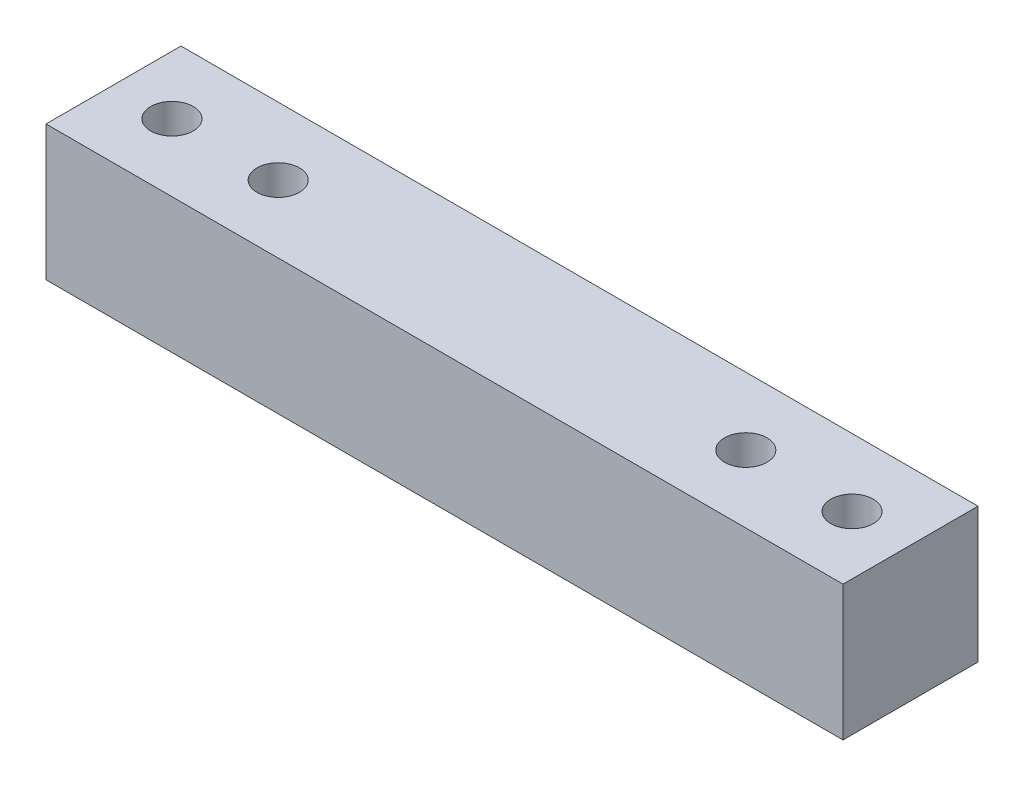
from build123d import *

# Parameters (mm, degrees)
SKETCH1_W           = 75
SKETCH1_H           = 12.7
BOSS_EXTRUDE1_DEPTH = 12.7
SKETCH2_R           = 2
CUT_EXTRUDE1_DEPTH  = 78.120554977
BOSS_EXTRUDE2_DEPTH = 1


with BuildPart() as part:
    # Sketch1 → Boss-Extrude1 (new body)
    with BuildSketch(Plane(origin=(0, 0, 0), x_dir=(1, 0, 0), z_dir=(0, 1, 0))):
        with Locations((37.5, 6.35)):
            Rectangle(SKETCH1_W, SKETCH1_H)
    extrude(amount=BOSS_EXTRUDE1_DEPTH)

    # Sketch2 → Cut-Extrude1 (cut, through all)
    with BuildSketch(Plane(origin=(0, 12.7, 0), x_dir=(1, 0, 0), z_dir=(0, 1, 0))):
        with Locations(Location((5.5, 6.35, 0), (0, 0, 270))):
            Circle(SKETCH2_R)
        with Locations(Location((15.5, 6.35, 0), (0, 0, 270))):
            Circle(SKETCH2_R)
        with Locations(Location((59.5, 6.35, 0), (0, 0, 270))):
            Circle(SKETCH2_R)
        with Locations(Location((69.5, 6.35, 0), (0, 0, 270))):
            Circle(SKETCH2_R)
    extrude(amount=-CUT_EXTRUDE1_DEPTH, mode=Mode.SUBTRACT)

    # Sketch3 → Boss-Extrude2 (add)
    # profile 1 of 3: a face of its own
    with BuildSketch(Plane.ZY):
        with BuildLine():
            Line((-8.766666667, 8), (-8.766666667, 7.641025641))
            Line((-8.766666667, 7.641025641), (-9.956470353, 7.641025641))
            Line((-9.956470353, 7.641025641), (-10.145773237, 6.720452724))
            add(Edge.make_bspline(
                [(-10.145773237, 6.720452724), (-10.108717363, 6.730682996), (-10.036927467, 6.75050253), (-9.930967606, 6.7725083), (-9.830375403, 6.785773744), (-9.765100032, 6.787585055), (-9.733513622, 6.788461538)],
                knots=[0, 0, 0, 0, 1.100273476, 2.13160584, 3.095893838, 4, 4, 4, 4], degree=3))
            add(Edge.make_bspline(
                [(-9.733513622, 6.788461538), (-9.694429882, 6.787615603), (-9.617581485, 6.785952282), (-9.505142538, 6.769980432), (-9.397809645, 6.744840518), (-9.295807274, 6.709719996), (-9.198946724, 6.664810263), (-9.108119162, 6.608710322), (-9.021961249, 6.543176991), (-8.942018655, 6.467831979), (-8.869494347, 6.384910363), (-8.805728357, 6.295752492), (-8.751565767, 6.201224829), (-8.708005012, 6.100424221), (-8.673220678, 5.994465067), (-8.650068683, 5.882232485), (-8.634651974, 5.764784365), (-8.632929588, 5.684479795), (-8.632051282, 5.643529647)],
                knots=[0, 0, 0, 0, 1.052922333, 2.070308379, 3.05430497, 4.020497103, 4.973039431, 5.925935799, 6.892292201, 7.88610001, 8.88166317, 9.857072816, 10.836096531, 11.812156883, 12.81219415, 13.836441305, 14.89672472, 16, 16, 16, 16], degree=3))
            add(Edge.make_bspline(
                [(-8.632051282, 5.643529647), (-8.632716357, 5.615007427), (-8.63403752, 5.55834844), (-8.640756108, 5.474204239), (-8.653691824, 5.391841406), (-8.671059548, 5.311249014), (-8.693601966, 5.232579642), (-8.72089102, 5.155608114), (-8.754287047, 5.080813507), (-8.790918422, 5.007488112), (-8.8321649, 4.937289605), (-8.877943408, 4.871640618), (-8.926308899, 4.809556337), (-8.978350284, 4.751702604), (-9.03455128, 4.698459586), (-9.094231246, 4.649511304), (-9.156913965, 4.604029974), (-9.223569208, 4.563861779), (-9.292711691, 4.526898823), (-9.365339908, 4.496575285), (-9.439800608, 4.469464757), (-9.517165484, 4.44785523), (-9.597259297, 4.430922675), (-9.680214072, 4.419422075), (-9.765594742, 4.411045637), (-9.823469755, 4.41052128), (-9.852704327, 4.41025641)],
                knots=[0, 0, 0, 0, 1.056347294, 2.098418968, 3.122841568, 4.141288669, 5.149314143, 6.15115421, 7.162517403, 8.180376062, 9.185164535, 10.17417709, 11.141909838, 12.097768115, 13.052685741, 14.0056014, 14.954263652, 15.917497458, 16.885230207, 17.854509472, 18.828990115, 19.81800267, 20.826176721, 21.857883937, 22.917946725, 24, 24, 24, 24], degree=3))
            add(Edge.make_bspline(
                [(-9.852704327, 4.41025641), (-9.887578508, 4.410947248), (-9.956189338, 4.41230639), (-10.056709905, 4.426524876), (-10.153424511, 4.446888792), (-10.245554612, 4.477525062), (-10.333925876, 4.515912357), (-10.417348594, 4.564428528), (-10.49795437, 4.619407632), (-10.572466407, 4.684287985), (-10.64162252, 4.755203667), (-10.703529029, 4.832161308), (-10.758662606, 4.91389075), (-10.806140353, 5.000788904), (-10.846638374, 5.092627435), (-10.878453362, 5.189750436), (-10.904131717, 5.29165044), (-10.914995138, 5.36180395), (-10.920512821, 5.397435897)],
                knots=[0, 0, 0, 0, 1.0467383, 2.05933395, 3.04377827, 4.011590433, 4.970194871, 5.932262533, 6.905835911, 7.896367577, 8.894135286, 9.877477877, 10.858688626, 11.851381753, 12.8477658, 13.868841284, 14.917554742, 16, 16, 16, 16], degree=3))
            Line((-10.920512821, 5.397435897), (-10.606410256, 5.397435897))
            add(Edge.make_bspline(
                [(-10.606410256, 5.397435897), (-10.598681699, 5.364059445), (-10.583826983, 5.29990805), (-10.551221234, 5.209776709), (-10.511355358, 5.129457485), (-10.46395101, 5.057887902), (-10.407400979, 4.995478905), (-10.342871551, 4.939861843), (-10.270523827, 4.889686713), (-10.190130598, 4.847863946), (-10.105317518, 4.812195193), (-10.016550308, 4.788443498), (-9.926245962, 4.771742605), (-9.865167592, 4.770070844), (-9.83447516, 4.769230769)],
                knots=[0, 0, 0, 0, 1.136247022, 2.183929868, 3.172523383, 4.106158343, 5.02341133, 5.958108904, 6.928429099, 7.938127109, 8.96079061, 9.975095812, 10.982467395, 12, 12, 12, 12], degree=3))
            add(Edge.make_bspline(
                [(-9.83447516, 4.769230769), (-9.804516716, 4.770051547), (-9.745528294, 4.771667666), (-9.658716907, 4.784106678), (-9.574904033, 4.803264249), (-9.494916676, 4.831934104), (-9.417355136, 4.866778822), (-9.344181366, 4.911493898), (-9.273278489, 4.962953917), (-9.206850355, 5.021910547), (-9.146010906, 5.086880241), (-9.092254785, 5.156357635), (-9.047477872, 5.230474481), (-9.009743763, 5.307947634), (-8.981090464, 5.389626191), (-8.960649483, 5.475127366), (-8.948646424, 5.564662347), (-8.946995244, 5.625731656), (-8.946153846, 5.656850962)],
                knots=[0, 0, 0, 0, 1.027316725, 2.022795036, 3.002884548, 3.971462791, 4.93288096, 5.914575861, 6.907176829, 7.935150275, 8.956128384, 9.956726525, 10.942570165, 11.921478529, 12.907843606, 13.90538589, 14.932640048, 16, 16, 16, 16], degree=3))
            add(Edge.make_bspline(
                [(-8.946153846, 5.656850962), (-8.946812326, 5.684926713), (-8.948101205, 5.739881002), (-8.958631776, 5.820280209), (-8.976948748, 5.896353251), (-9.002372628, 5.968467485), (-9.034652136, 6.036690927), (-9.074098448, 6.101093987), (-9.121451846, 6.160827821), (-9.175543735, 6.215920374), (-9.234801776, 6.266765249), (-9.300245518, 6.310109336), (-9.370505445, 6.346573253), (-9.444735044, 6.378041252), (-9.524699943, 6.400641997), (-9.608816575, 6.417609882), (-9.697993283, 6.427425245), (-9.758963972, 6.428787134), (-9.790304487, 6.429487179)],
                knots=[0, 0, 0, 0, 1.045622112, 2.046656509, 3.013763289, 3.955457236, 4.890082067, 5.820317437, 6.762574623, 7.722996705, 8.69280354, 9.665887285, 10.63943826, 11.638615906, 12.663482002, 13.728887084, 14.832589034, 16, 16, 16, 16], degree=3))
            add(Edge.make_bspline(
                [(-9.790304487, 6.429487179), (-9.817433416, 6.428906588), (-9.873447771, 6.427707815), (-9.959370598, 6.418881318), (-10.049662321, 6.404642024), (-10.143976817, 6.385055776), (-10.242597325, 6.359424699), (-10.345315725, 6.328710199), (-10.452347992, 6.2919882), (-10.524465716, 6.264255986), (-10.561538462, 6.25)],
                knots=[0, 0, 0, 0, 0.817624296, 1.688186739, 2.600797293, 3.572016777, 4.590301741, 5.671205678, 6.80286297, 8, 8, 8, 8], degree=3))
            Line((-10.561538462, 6.25), (-10.202564103, 8))
            Line((-10.202564103, 8), (-8.766666667, 8))
        make_face()
    # profile 2 of 3: a face of its own
    with BuildSketch(Plane.ZY):
        Polygon((-8.048717949, 8.08974359), (-7.734615385, 8.08974359), (-7.734615385, 6.014423077), (-6.570052083, 7.057692308), (-6.119230769, 7.057692308), (-7.469591346, 5.846153846), (-5.984615385, 4.5), (-6.435436699, 4.5), (-7.734615385, 5.678585737), (-7.734615385, 4.5), (-8.048717949, 4.5), align=None)
    # profile 3 of 3: a face of its own
    with BuildSketch(Plane.ZY):
        with BuildLine():
            Line((-3.382051282, 7.057692308), (-3.067948718, 7.057692308))
            Line((-3.067948718, 7.057692308), (-3.067948718, 5.027944712))
            add(Edge.make_bspline(
                [(-3.067948718, 5.027944712), (-3.068225761, 4.984707117), (-3.068760519, 4.901248144), (-3.072611491, 4.780569865), (-3.080732168, 4.669103779), (-3.089940849, 4.56634152), (-3.103187566, 4.47275941), (-3.119363933, 4.388078206), (-3.137599612, 4.312216643), (-3.153619829, 4.265491802), (-3.161197917, 4.243389423)],
                knots=[0, 0, 0, 0, 1.307562039, 2.523909702, 3.650326591, 4.686913197, 5.643429486, 6.506965704, 7.293745905, 8, 8, 8, 8], degree=3))
            add(Edge.make_bspline(
                [(-3.161197917, 4.243389423), (-3.172387155, 4.214659501), (-3.194431082, 4.158058664), (-3.235716715, 4.077824344), (-3.281950619, 4.002277954), (-3.33475737, 3.931840503), (-3.393898174, 3.86686559), (-3.457979666, 3.805941591), (-3.528249857, 3.750357423), (-3.604668569, 3.701072126), (-3.685474203, 3.656685072), (-3.770620305, 3.618238505), (-3.859626743, 3.584751661), (-3.953329635, 3.559668865), (-4.050259869, 3.537934145), (-4.1515573, 3.523789459), (-4.256630097, 3.514162401), (-4.328075477, 3.513272168), (-4.364322917, 3.512820513)],
                knots=[0, 0, 0, 0, 0.981931301, 1.934503488, 2.87077864, 3.801706999, 4.735015492, 5.667491629, 6.616593066, 7.585388521, 8.561939025, 9.551802639, 10.560317337, 11.588439944, 12.640189604, 13.723962949, 14.845264515, 16, 16, 16, 16], degree=3))
            add(Edge.make_bspline(
                [(-4.364322917, 3.512820513), (-4.417207651, 3.513676999), (-4.520505746, 3.515349946), (-4.671110739, 3.534840861), (-4.814145459, 3.562395234), (-4.947719916, 3.604100661), (-5.070990013, 3.655137651), (-5.183113888, 3.713732604), (-5.283084996, 3.780921913), (-5.373208669, 3.857422514), (-5.454550259, 3.948386195), (-5.531077549, 4.055585039), (-5.604738491, 4.180651929), (-5.647907129, 4.272444642), (-5.670512821, 4.320512821)],
                knots=[0, 0, 0, 0, 1.157897085, 2.2616841, 3.32207898, 4.345638746, 5.321241055, 6.241986252, 7.112515963, 7.955008012, 8.825025602, 9.77857164, 10.836726669, 12, 12, 12, 12], degree=3))
            Line((-5.670512821, 4.320512821), (-5.356410256, 4.320512821))
            add(Edge.make_bspline(
                [(-5.356410256, 4.320512821), (-5.331148047, 4.280406945), (-5.281763539, 4.202004896), (-5.189415058, 4.10049174), (-5.088208731, 4.013738376), (-4.974729048, 3.943827602), (-4.848503833, 3.89111781), (-4.709457147, 3.853542514), (-4.556457525, 3.831046247), (-4.449939311, 3.828334953), (-4.394471154, 3.826923077)],
                knots=[0, 0, 0, 0, 0.997731894, 1.950442991, 2.880492273, 3.800895997, 4.748200782, 5.754801363, 6.83083817, 8, 8, 8, 8], degree=3))
            add(Edge.make_bspline(
                [(-4.394471154, 3.826923077), (-4.339704264, 3.828353226), (-4.234119181, 3.831110409), (-4.082288012, 3.853552554), (-3.943693074, 3.891125987), (-3.819132873, 3.943734374), (-3.710077105, 4.00818478), (-3.616065113, 4.080184855), (-3.539920437, 4.161365858), (-3.48870747, 4.236147664), (-3.456872853, 4.302771793), (-3.436600616, 4.360124389), (-3.420126647, 4.424977267), (-3.406346809, 4.497113003), (-3.394975896, 4.57663466), (-3.387773013, 4.663724064), (-3.382567202, 4.758183286), (-3.382227232, 4.823676424), (-3.382051282, 4.857572115)],
                knots=[0, 0, 0, 0, 1.570740765, 3.028230971, 4.391408896, 5.680370741, 6.894727393, 8.017376726, 9.065722033, 10.075533815, 10.603371122, 11.180248986, 11.817768598, 12.521299649, 13.286540596, 14.121245857, 15.027658897, 16, 16, 16, 16], degree=3))
            Line((-3.382051282, 4.857572115), (-3.382051282, 4.990084135))
            add(Edge.make_bspline(
                [(-3.382051282, 4.990084135), (-3.413932399, 4.952142332), (-3.477133855, 4.876926113), (-3.586281182, 4.778364476), (-3.705498098, 4.693478346), (-3.83458164, 4.623859711), (-3.970369883, 4.568178287), (-4.111392113, 4.529235326), (-4.256384168, 4.504075426), (-4.354636318, 4.50136811), (-4.404286859, 4.5)],
                knots=[0, 0, 0, 0, 1.012485704, 2.007162095, 2.997754123, 3.998611389, 4.999708251, 5.992315798, 6.98544096, 8, 8, 8, 8], degree=3))
            add(Edge.make_bspline(
                [(-4.404286859, 4.5), (-4.433523128, 4.500515026), (-4.491649686, 4.501538985), (-4.578004433, 4.510497762), (-4.663084872, 4.523496504), (-4.746692575, 4.542577943), (-4.828948188, 4.56706967), (-4.90971578, 4.597686409), (-4.989649307, 4.632301527), (-5.067295805, 4.67307433), (-5.141881935, 4.718436637), (-5.212845121, 4.767575528), (-5.27981366, 4.820233816), (-5.342150149, 4.876930756), (-5.399772821, 4.937584289), (-5.453456689, 5.001547842), (-5.502314036, 5.069714583), (-5.547347425, 5.140841541), (-5.586404975, 5.215402464), (-5.620689347, 5.29178056), (-5.650498752, 5.369812514), (-5.674264154, 5.449759577), (-5.692415267, 5.531571346), (-5.705925494, 5.615113795), (-5.713588426, 5.700644182), (-5.71478335, 5.758265532), (-5.715384615, 5.787259615)],
                knots=[0, 0, 0, 0, 1.028754217, 2.045334182, 3.052854819, 4.056607503, 5.061168794, 6.071104265, 7.095078842, 8.125279047, 9.155117945, 10.165957491, 11.161587969, 12.151493252, 13.128948131, 14.104219989, 15.088194871, 16.07871515, 17.064853787, 18.047899887, 19.02414258, 20.002704429, 20.980574569, 21.971845993, 22.979467364, 24, 24, 24, 24], degree=3))
            add(Edge.make_bspline(
                [(-5.715384615, 5.787259615), (-5.714865449, 5.816262711), (-5.713829127, 5.87415657), (-5.704878148, 5.960035956), (-5.692109959, 6.044765391), (-5.67190219, 6.127471533), (-5.647579667, 6.209096284), (-5.617456095, 6.289036741), (-5.581237335, 6.36731725), (-5.540227586, 6.443995781), (-5.494143493, 6.518043396), (-5.443611012, 6.588370042), (-5.388569138, 6.654458214), (-5.329777222, 6.716974636), (-5.266517405, 6.775316129), (-5.198822413, 6.829341094), (-5.127359533, 6.87995512), (-5.051907283, 6.926066457), (-4.973629894, 6.966848704), (-4.894516076, 7.004061301), (-4.813517841, 7.03359542), (-4.732145302, 7.059618519), (-4.648965387, 7.078053715), (-4.564997993, 7.092275957), (-4.479955656, 7.100940678), (-4.423002761, 7.102022263), (-4.394471154, 7.102564103)],
                knots=[0, 0, 0, 0, 1.008818848, 2.013730394, 3.001654427, 3.987803273, 4.973046549, 5.963777569, 6.957074694, 7.972068341, 8.987420212, 9.989399531, 10.982630087, 11.977756091, 12.973280677, 13.973972381, 14.989194003, 16.018387222, 17.047741039, 18.059210846, 19.057554164, 20.045176975, 21.029480261, 22.018708529, 23.007435371, 24, 24, 24, 24], degree=3))
            add(Edge.make_bspline(
                [(-4.394471154, 7.102564103), (-4.347420215, 7.101207429), (-4.254509068, 7.098528416), (-4.117778065, 7.077507271), (-3.985835825, 7.043993258), (-3.857937809, 6.995977627), (-3.733042158, 6.930427589), (-3.611560503, 6.844084641), (-3.493141369, 6.736174301), (-3.420063538, 6.653421437), (-3.382051282, 6.610376603)],
                knots=[0, 0, 0, 0, 0.96728863, 1.910097829, 2.838038873, 3.762875196, 4.71315279, 5.730631239, 6.819562287, 8, 8, 8, 8], degree=3))
            Line((-3.382051282, 6.610376603), (-3.382051282, 7.057692308))
        make_face()
        with BuildLine():
            add(Edge.make_bspline(
                [(-4.369230769, 6.788461538), (-4.415161473, 6.786900473), (-4.506094528, 6.783809894), (-4.63938287, 6.757425181), (-4.768059803, 6.716079281), (-4.889665232, 6.656936666), (-5.003572342, 6.584842428), (-5.104647162, 6.49750214), (-5.193052078, 6.397755943), (-5.267835016, 6.286505696), (-5.327366383, 6.166483421), (-5.369509802, 6.039972687), (-5.396759826, 5.909017694), (-5.399767478, 5.819645091), (-5.401282051, 5.774639423)],
                knots=[0, 0, 0, 0, 1.026226791, 2.031711442, 3.026614839, 4.04107745, 5.047145931, 6.032893242, 7.017642609, 8.019221815, 9.021877557, 10.003543541, 10.994637589, 12, 12, 12, 12], degree=3))
            add(Edge.make_bspline(
                [(-5.401282051, 5.774639423), (-5.400556294, 5.740706151), (-5.399128943, 5.673969327), (-5.385405365, 5.576031432), (-5.3632244, 5.482751118), (-5.331787194, 5.394122744), (-5.292834499, 5.309637949), (-5.243842128, 5.229878714), (-5.186191156, 5.154774008), (-5.120332818, 5.084879326), (-5.047756436, 5.021218358), (-4.969037237, 4.965280317), (-4.884281987, 4.919529596), (-4.795575177, 4.879988759), (-4.700764421, 4.851109691), (-4.601215335, 4.829070912), (-4.496223639, 4.816462154), (-4.424651899, 4.814899356), (-4.388161058, 4.814102564)],
                knots=[0, 0, 0, 0, 1.039728707, 2.044842319, 3.024901384, 3.974314358, 4.923051295, 5.871625912, 6.837440708, 7.820715446, 8.810779094, 9.792721783, 10.773906224, 11.758876063, 12.764959493, 13.806266761, 14.881525401, 16, 16, 16, 16], degree=3))
            add(Edge.make_bspline(
                [(-4.388161058, 4.814102564), (-4.351197299, 4.814870173), (-4.278915062, 4.816371224), (-4.173344126, 4.829274723), (-4.073311385, 4.850096699), (-3.978908563, 4.879659725), (-3.889779222, 4.917381475), (-3.806924607, 4.965118093), (-3.728568159, 5.019482525), (-3.65721175, 5.082894539), (-3.592687584, 5.152779534), (-3.536456817, 5.228824429), (-3.488542368, 5.309884948), (-3.448864698, 5.395951954), (-3.418573494, 5.487694307), (-3.398254589, 5.584882663), (-3.384047844, 5.687051401), (-3.382726919, 5.757060018), (-3.382051282, 5.79286859)],
                knots=[0, 0, 0, 0, 1.121943988, 2.193949579, 3.223793937, 4.220241907, 5.192961521, 6.155822191, 7.11847367, 8.083710714, 9.04790392, 10.001595906, 10.949595423, 11.902125208, 12.873731292, 13.87582262, 14.913508608, 16, 16, 16, 16], degree=3))
            add(Edge.make_bspline(
                [(-3.382051282, 5.79286859), (-3.38339085, 5.839486444), (-3.386007896, 5.930561349), (-3.410705053, 6.063268117), (-3.450525264, 6.18803679), (-3.506372016, 6.304472766), (-3.576354025, 6.411342316), (-3.660644873, 6.506666161), (-3.757790904, 6.590567017), (-3.867513004, 6.660465211), (-3.985560449, 6.716930645), (-4.109081645, 6.759292417), (-4.237893209, 6.783286732), (-4.325199619, 6.786726675), (-4.369230769, 6.788461538)],
                knots=[0, 0, 0, 0, 1.070913519, 2.092188694, 3.091357305, 4.074328408, 5.051968682, 6.018948707, 6.99050112, 7.9935919, 9.000589572, 9.992915277, 10.987769056, 12, 12, 12, 12], degree=3))
        make_face(mode=Mode.SUBTRACT)
    extrude(amount=BOSS_EXTRUDE2_DEPTH)


solid = part.part
